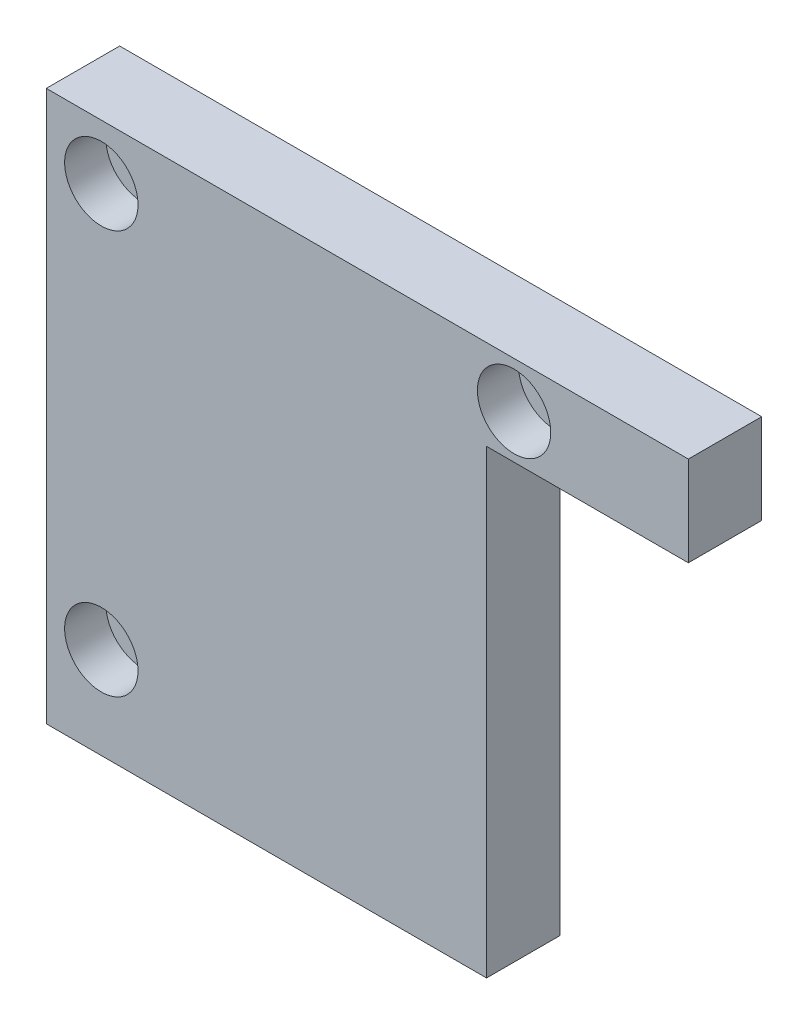
from build123d import *

# Parameters (mm, degrees)
BOSS_EXTRUDE1_DEPTH                     = 4
CBORE_FOR_M5_HEX_HEAD_BOLT1_D           = 4
CBORE_FOR_M5_HEX_HEAD_BOLT1_CBORE_D     = 8
CBORE_FOR_M5_HEX_HEAD_BOLT1_CBORE_DEPTH = 4.5


with BuildPart() as part:
    # Sketch1 → Boss-Extrude1 (new, symmetric)
    with BuildSketch(Plane.XY):
        Polygon((0, 44.484987277), (0, 0), (48, 0), (48, 50.2), (70, 50.2), (70, 60), (35, 60), (0, 60), align=None)
    extrude(amount=BOSS_EXTRUDE1_DEPTH, both=True)

    # CBORE for M5 Hex Head Bolt1 (through all)
    with Locations(Plane.XY.offset(4)):
        with Locations((6, 10), (6, 54), (51, 55)):
            CounterBoreHole(CBORE_FOR_M5_HEX_HEAD_BOLT1_D / 2, CBORE_FOR_M5_HEX_HEAD_BOLT1_CBORE_D / 2, CBORE_FOR_M5_HEX_HEAD_BOLT1_CBORE_DEPTH)


solid = part.part
